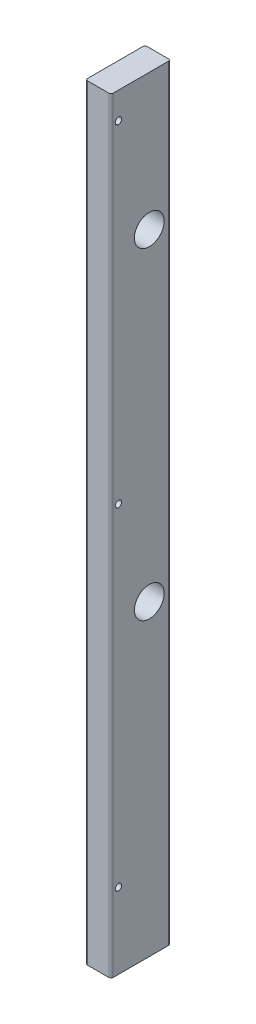
from build123d import *

# Parameters (mm, degrees)
SKETCH1_W           = 38.1
SKETCH1_H           = 88.9
BOSS_EXTRUDE1_DEPTH = 1143
SKETCH2_R           = 22.225
CUT_EXTRUDE4_DEPTH  = 918.6545
SKETCH3_R           = 4.7625
CUT_EXTRUDE5_DEPTH  = 1145.498323502
FILLET1_R           = 3.175


with BuildPart() as part:
    # Sketch1 → Boss-Extrude1 (new body)
    with BuildSketch(Plane(origin=(0, 0, 0), x_dir=(1, 0, 0), z_dir=(0, 1, 0))):
        Rectangle(SKETCH1_W, SKETCH1_H)
    extrude(amount=BOSS_EXTRUDE1_DEPTH)

    # Sketch2 → Cut-Extrude4 (cut)
    with BuildSketch(Plane(origin=(19.05, 0, 0), x_dir=(0, 0, -1), z_dir=(1, 0, 0))):
        with Locations((12.7, 458.7875)):
            Circle(SKETCH2_R)
        with Locations((12.7, 939.8)):
            Circle(SKETCH2_R)
    extrude(amount=-CUT_EXTRUDE4_DEPTH, mode=Mode.SUBTRACT)

    # Sketch3 → Cut-Extrude5 (cut, through all)
    with BuildSketch(Plane(origin=(19.05, 0, 0), x_dir=(0, 0, -1), z_dir=(1, 0, 0))):
        with Locations((-33.3375, 112.7125)):
            Circle(SKETCH3_R)
        with Locations((-33.3375, 608.0125)):
            Circle(SKETCH3_R)
        with Locations((-33.3375, 1103.3125)):
            Circle(SKETCH3_R)
    extrude(amount=-CUT_EXTRUDE5_DEPTH, mode=Mode.SUBTRACT)

    # Fillet1
    fillet1_edges = [part.edges().sort_by_distance(p)[0] for p in [
        (19.05, 571.5, 44.45),
        (-19.05, 571.5, 44.45),
        (-19.05, 571.5, -44.45),
        (19.05, 571.5, -44.45),
    ]]
    fillet(fillet1_edges, radius=FILLET1_R)


solid = part.part
